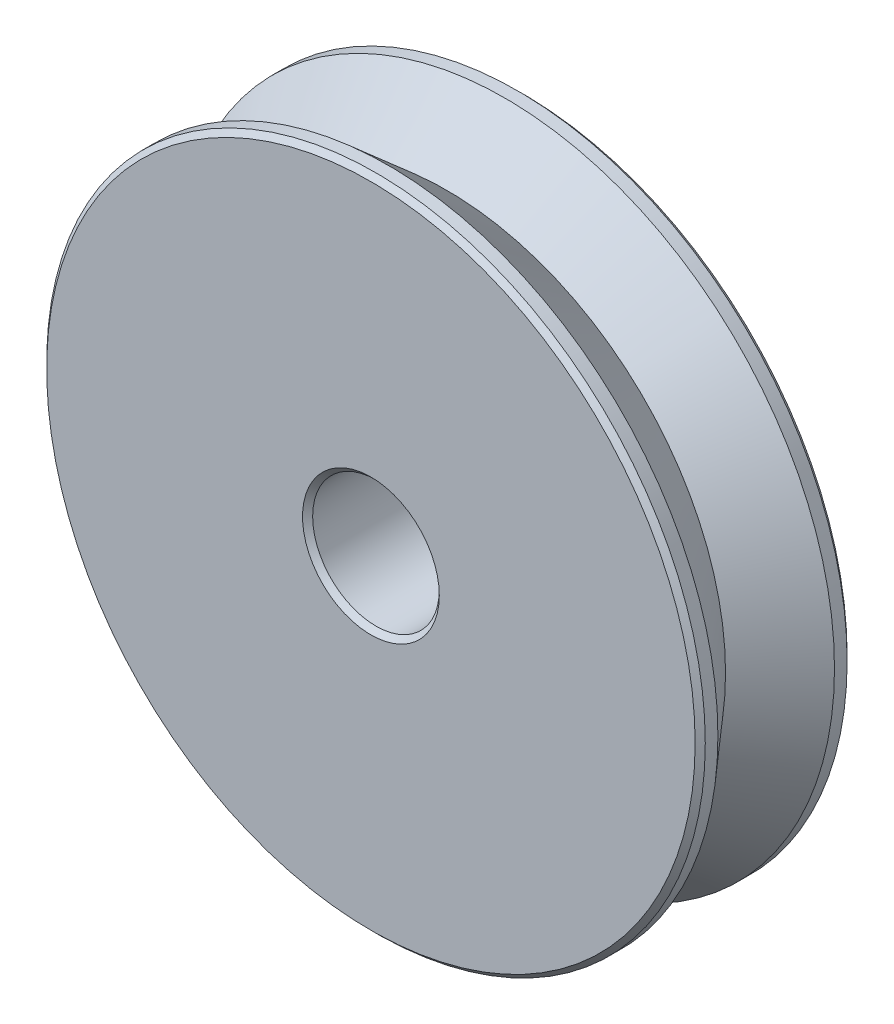
from build123d import *

# Parameters (mm, degrees)
SKETCH_1_R      = 13
SKETCH_1_R_2    = 2.5
EXTRUDE_1_DEPTH = 3
CHAMFER_1_SIZE  = 0.2


with BuildPart() as part:
    # 草图1 → 凸台-拉伸1 (new, symmetric)
    with BuildSketch(Plane.XY):
        Circle(SKETCH_1_R)
        Circle(SKETCH_1_R_2, mode=Mode.SUBTRACT)
    extrude(amount=EXTRUDE_1_DEPTH, both=True)

    # 草图2 → 切除-旋转1 (revolve, cut)
    with BuildSketch(Plane(origin=(0, 0, 0), x_dir=(0, 0, -1), z_dir=(1, 0, 0)), mode=Mode.PRIVATE) as cut_revolve_1_sk:
        Polygon((0, 11), (2.301135457, 13), (-2.301135457, 13), align=None)
    revolve(cut_revolve_1_sk.sketch.rotate(Axis((0, 0, 0), (0, 0, -1)), 90), axis=Axis((0, 0, 0), (0, 0, -1)), mode=Mode.SUBTRACT)

    # 倒角1
    chamfer_1_edges = [part.edges().sort_by_distance(p)[0] for p in [
        (-13, 0, -3),
        (-13, 0, 3),
        (-2.5, 0, -3),
        (-2.5, 0, 3),
    ]]
    chamfer(chamfer_1_edges, length=CHAMFER_1_SIZE)


solid = part.part
